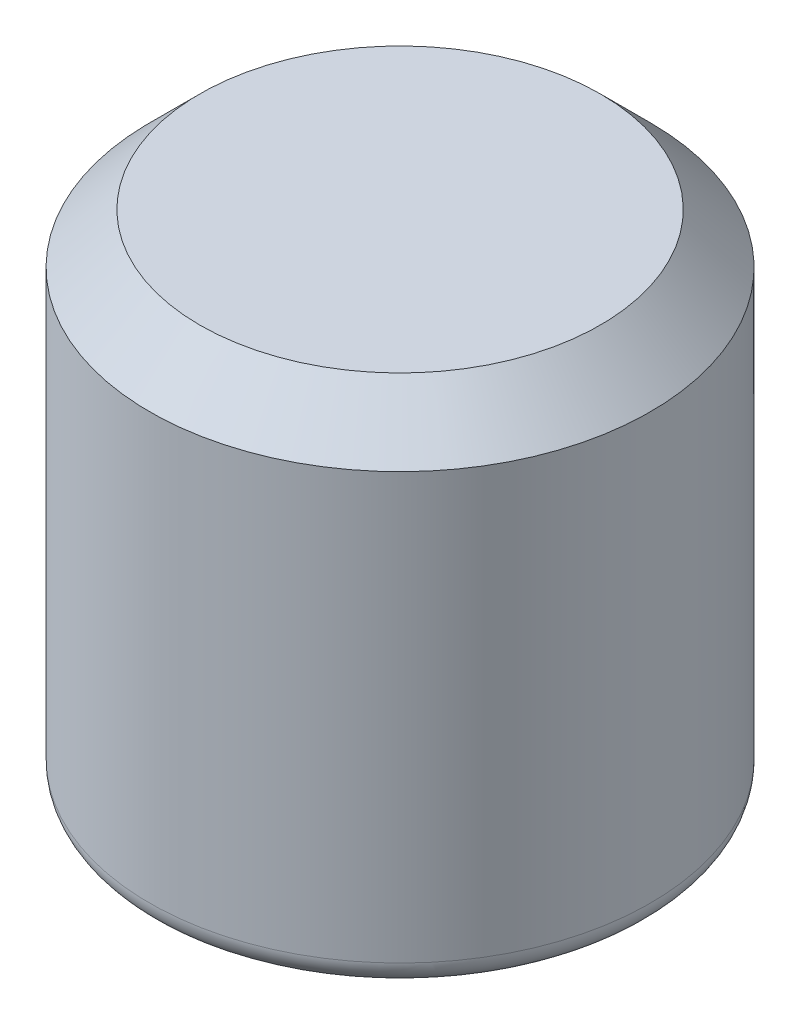
from build123d import *

# Parameters (mm, degrees)
FEATURE_ROUND_R = 1


with BuildPart() as part:
    # sketch:profile → feature:turned (revolve)
    with BuildSketch(Plane.XY, mode=Mode.PRIVATE) as feature_turned_sk:
        Polygon((0, 0), (10, 0), (10, 18), (8, 20), (0, 20), align=None)
    revolve(feature_turned_sk.sketch.rotate(Axis((0, -10, 0), (0, 1, 0)), 90), axis=Axis((0, -10, 0), (0, 1, 0)))

    # feature:round
    feature_round_edges = [part.edges().sort_by_distance(p)[0] for p in [
        (0, 0, 10),
    ]]
    fillet(feature_round_edges, radius=FEATURE_ROUND_R)


solid = part.part
